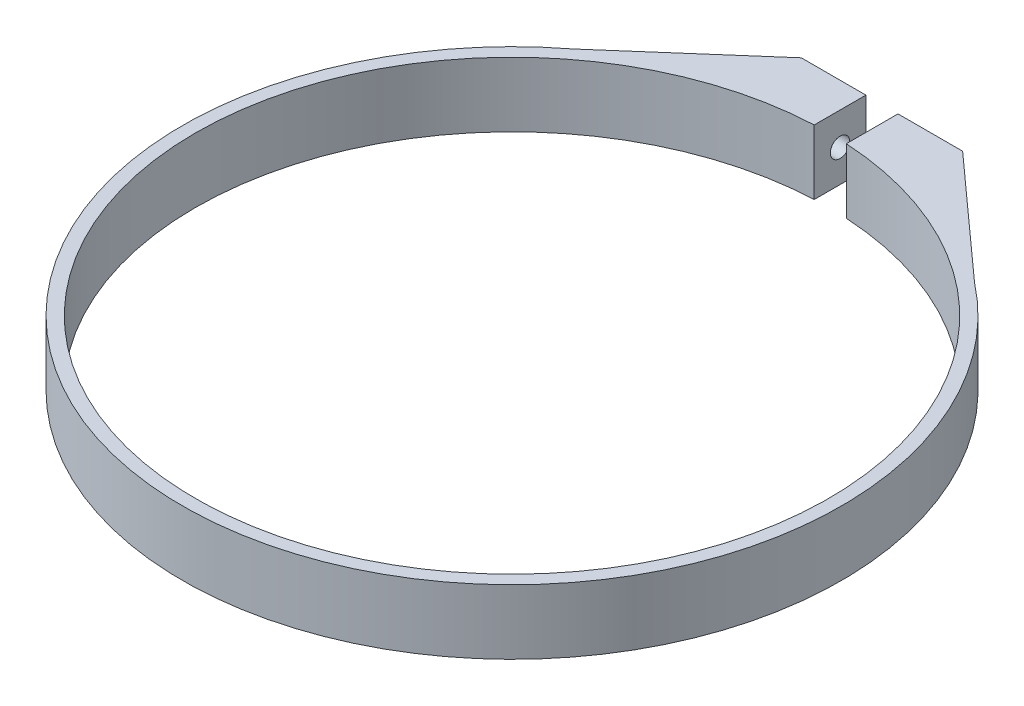
from build123d import *

# Parameters (mm, degrees)
BOSS_EXTRUDE1_DEPTH                                = 10
SKETCH2_W                                          = 49
SKETCH2_H                                          = 10
SKETCH3_W                                          = 1.25
SKETCH3_H                                          = 48.182761149
CBORE_FOR_M2_5_HEX_HEAD_MACHINE_SCREW1_D           = 3
CBORE_FOR_M2_5_HEX_HEAD_MACHINE_SCREW1_DEPTH       = 70.616262821
CBORE_FOR_M2_5_HEX_HEAD_MACHINE_SCREW1_CBORE_D     = 5
CBORE_FOR_M2_5_HEX_HEAD_MACHINE_SCREW1_CBORE_DEPTH = 12.433501671


with BuildPart() as part:
    # Sketch1 → Boss-Extrude1 (new body)
    with BuildSketch(Plane(origin=(0, 10, 0), x_dir=(1, 0, 0), z_dir=(0, 1, 0))):
        with BuildLine():
            Line((2.817238851, 56.91894485), (2.817238851, 48.91894485))
            ThreePointArc((2.817238851, 48.91894485), (0.317652576, 48.998970365), (-2.182761149, 48.951359059))
            Line((-2.182761149, 48.951359059), (-2.182761149, 56.951359059))
            Line((-2.182761149, 56.951359059), (-12.182761149, 56.951359059))
            Line((-12.182761149, 56.951359059), (-31.002590128, 40.494930613))
            ThreePointArc((-31.002590128, 40.494930613), (-0.248614246, -50.999394025), (31.395920468, 40.190747417))
            Line((31.395920468, 40.190747417), (12.817238851, 56.91894485))
            Line((12.817238851, 56.91894485), (2.817238851, 56.91894485))
        make_face()
    extrude(amount=-BOSS_EXTRUDE1_DEPTH)

    # Sketch2 → Cut-Revolve1 (revolve, cut)
    with BuildSketch(Plane.XY):
        with Locations((24.5, 5)):
            Rectangle(SKETCH2_W, SKETCH2_H)
    revolve(axis=Axis((0, 10, 0), (0, -1, 0)), mode=Mode.SUBTRACT)

    # Sketch3 → Ø2.5 (2.5) Diameter Hole1 (revolve, cut)
    with BuildSketch(Plane(origin=(2.817238851, 5, -52.91894485), x_dir=(0, 0, 1), z_dir=(0, 1, 0))):
        with Locations((0.625, 24.091380575)):
            Rectangle(SKETCH3_W, SKETCH3_H)
    revolve(axis=Axis((-3.532761149, 5, -52.91894485), (1, 0, 0)), mode=Mode.SUBTRACT)

    # CBORE for M2.5 Hex Head Machine Screw1
    with Locations(Plane.ZY.offset(19.616262821)):
        with Locations((-52.951359059, 5)):
            CounterBoreHole(CBORE_FOR_M2_5_HEX_HEAD_MACHINE_SCREW1_D / 2, CBORE_FOR_M2_5_HEX_HEAD_MACHINE_SCREW1_CBORE_D / 2, CBORE_FOR_M2_5_HEX_HEAD_MACHINE_SCREW1_CBORE_DEPTH, depth=CBORE_FOR_M2_5_HEX_HEAD_MACHINE_SCREW1_DEPTH)


solid = part.part
